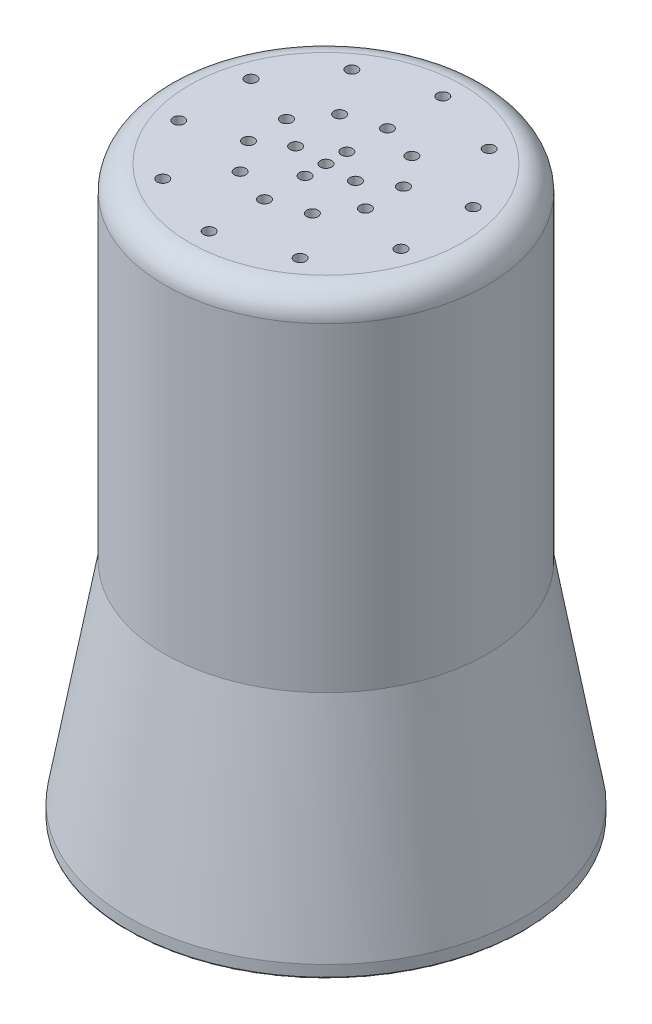
from build123d import *

# Parameters (mm, degrees)
SKETCH2_R          = 2.3
CUT_EXTRUDE1_DEPTH = 10
SKETCH4_R          = 2.3
CUT_EXTRUDE2_DEPTH = 6.25
CHAMFER3_SIZE      = 20
FILLET10_R         = 10
FILLET15_R         = 0.5


with BuildPart() as part:
    # Sketch1 → Revolve1 (revolve)
    with BuildSketch(Plane.XY):
        Polygon((80.5, 5), (65.5, 90.069227294), (65.5, 230), (0, 230), (0, 220), (62.5, 220), (62.5, 0), (80.5, 0), align=None)
    revolve(axis=Axis((0, 230, 0), (0, -1, 0)))

    # Sketch2 → Cut-Extrude1 (cut)
    with BuildSketch(Plane.XZ):
        with Locations((73, 0)):
            Circle(SKETCH2_R)
        with Locations((67.443205873, -27.935890563)):
            Circle(SKETCH2_R)
        with Locations((51.618795027, -51.618795027)):
            Circle(SKETCH2_R)
        with Locations((27.935890563, -67.443205873)):
            Circle(SKETCH2_R)
        with Locations((0, -73)):
            Circle(SKETCH2_R)
        with Locations((-27.935890563, -67.443205873)):
            Circle(SKETCH2_R)
        with Locations((-51.618795027, -51.618795027)):
            Circle(SKETCH2_R)
        with Locations((-67.443205873, -27.935890563)):
            Circle(SKETCH2_R)
        with Locations((-73, 0)):
            Circle(SKETCH2_R)
        with Locations((-67.443205873, 27.935890563)):
            Circle(SKETCH2_R)
        with Locations((-51.618795027, 51.618795027)):
            Circle(SKETCH2_R)
        with Locations((-27.935890563, 67.443205873)):
            Circle(SKETCH2_R)
        with Locations((0, 73)):
            Circle(SKETCH2_R)
        with Locations((27.935890563, 67.443205873)):
            Circle(SKETCH2_R)
        with Locations((51.618795027, 51.618795027)):
            Circle(SKETCH2_R)
        with Locations((67.443205873, 27.935890563)):
            Circle(SKETCH2_R)
    extrude(amount=-CUT_EXTRUDE1_DEPTH, mode=Mode.SUBTRACT)

    # Sketch4 → Cut-Extrude2 (cut)
    with BuildSketch(Plane(origin=(0, 230, 0), x_dir=(1, 0, 0), z_dir=(0, 1, 0))):
        with Locations((0, 47.5)):
            Circle(SKETCH4_R)
        with Locations((0, 25)):
            Circle(SKETCH4_R)
        with Locations((27.919799484, 38.428307233)):
            Circle(SKETCH4_R)
        with Locations((14.694631307, 20.225424859)):
            Circle(SKETCH4_R)
        with Locations((45.175184524, 14.678307233)):
            Circle(SKETCH4_R)
        with Locations((23.776412907, 7.725424859)):
            Circle(SKETCH4_R)
        with Locations((45.175184524, -14.678307233)):
            Circle(SKETCH4_R)
        with Locations((23.776412907, -7.725424859)):
            Circle(SKETCH4_R)
        with Locations((27.919799484, -38.428307233)):
            Circle(SKETCH4_R)
        with Locations((14.694631307, -20.225424859)):
            Circle(SKETCH4_R)
        with Locations((0, -47.5)):
            Circle(SKETCH4_R)
        with Locations((0, -25)):
            Circle(SKETCH4_R)
        with Locations((-27.919799484, -38.428307233)):
            Circle(SKETCH4_R)
        with Locations((-14.694631307, -20.225424859)):
            Circle(SKETCH4_R)
        with Locations((-45.175184524, -14.678307233)):
            Circle(SKETCH4_R)
        with Locations((-23.776412907, -7.725424859)):
            Circle(SKETCH4_R)
        with Locations((-45.175184524, 14.678307233)):
            Circle(SKETCH4_R)
        with Locations((-23.776412907, 7.725424859)):
            Circle(SKETCH4_R)
        with Locations((-27.919799484, 38.428307233)):
            Circle(SKETCH4_R)
        with Locations((-14.694631307, 20.225424859)):
            Circle(SKETCH4_R)
        Circle(SKETCH4_R)
        with Locations((11.997484215, 0)):
            Circle(SKETCH4_R)
        with Locations((-12.341543393, 0)):
            Circle(SKETCH4_R)
        with Locations((0, 8.5)):
            Circle(SKETCH4_R)
        with Locations((0, -8.5)):
            Circle(SKETCH4_R)
    extrude(amount=-CUT_EXTRUDE2_DEPTH, mode=Mode.SUBTRACT)

    # Chamfer3
    chamfer3_edges = [part.edges().sort_by_distance(p)[0] for p in [
        (-62.5, 220, 0),
    ]]
    chamfer(chamfer3_edges, length=CHAMFER3_SIZE)

    # Fillet10
    fillet10_edges = [part.edges().sort_by_distance(p)[0] for p in [
        (-65.5, 230, 0),
    ]]
    fillet(fillet10_edges, radius=FILLET10_R)

    # Fillet15
    fillet15_edges = [part.edges().sort_by_distance(p)[0] for p in [
        (-80.5, 0, 0),
    ]]
    fillet(fillet15_edges, radius=FILLET15_R)


solid = part.part
